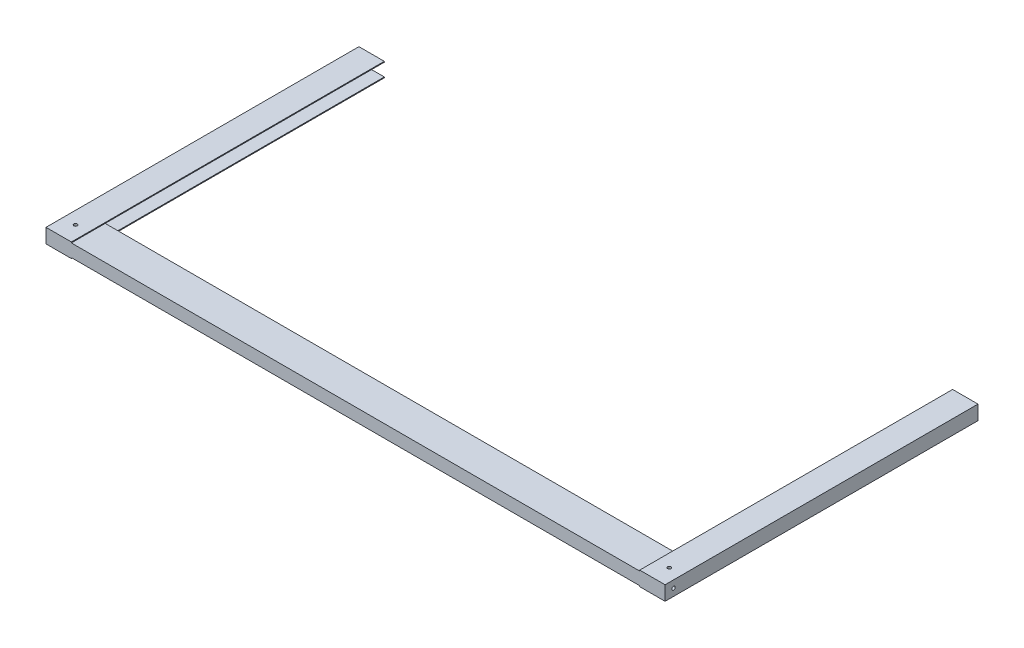
from build123d import *

# Parameters (mm, degrees)
CROQUIS1_W              = 730
CROQUIS1_H              = 15
SALIENTE_EXTRUIR1_DEPTH = 40
SALIENTE_EXTRUIR2_DEPTH = 370
CROQUIS3_R              = 2
CORTAR_EXTRUIR1_DEPTH   = 10
CROQUIS4_R              = 2
CORTAR_EXTRUIR2_DEPTH   = 10
CORTAR_EXTRUIR3_START   = -10
CROQUIS5_R              = 2
CORTAR_EXTRUIR3_DEPTH   = 10


with BuildPart() as part:
    # Croquis1 → Saliente-Extruir1 (new body)
    with BuildSketch(Plane.XY):
        Rectangle(CROQUIS1_W, CROQUIS1_H)
    extrude(amount=SALIENTE_EXTRUIR1_DEPTH)

    # Croquis2 → Saliente-Extruir2 (add)
    with BuildSketch(Plane.XY.offset(40)):
        Polygon((-366, -8.5), (-336, -8.5), (-336, -7.5), (-365, -7.5), (-365, 7.5), (-336, 7.5), (-336, 8.5), (-366, 8.5), align=None)
        Polygon((336, 8.5), (366, 8.5), (366, -8.5), (336, -8.5), (336, -7.5), (365, -7.5), (365, 7.5), (336, 7.5), align=None)
    extrude(amount=-SALIENTE_EXTRUIR2_DEPTH)

    # Croquis3 → Cortar-Extruir1 (cut)
    with BuildSketch(Plane(origin=(0, 8.5, 0), x_dir=(1, 0, 0), z_dir=(0, 1, 0))):
        with Locations(Location((351, -20, 0), (0, 0, 270))):
            Circle(CROQUIS3_R)
        with Locations(Location((-351, -20, 0), (0, 0, 270))):
            Circle(CROQUIS3_R)
    extrude(amount=-CORTAR_EXTRUIR1_DEPTH, mode=Mode.SUBTRACT)

    # Croquis4 → Cortar-Extruir2 (cut)
    with BuildSketch(Plane(origin=(366, 0, 0), x_dir=(0, 0, -1), z_dir=(1, 0, 0))):
        with Locations((-30, 0)):
            Circle(CROQUIS4_R)
    extrude(amount=-CORTAR_EXTRUIR2_DEPTH, mode=Mode.SUBTRACT)

    # Croquis5 → Cortar-Extruir3 (cut)
    with BuildSketch(Plane.ZY.offset(366).offset(CORTAR_EXTRUIR3_START)):
        with Locations(Location((30, 0, 0), (0, 0, 180))):
            Circle(CROQUIS5_R)
    extrude(amount=CORTAR_EXTRUIR3_DEPTH, mode=Mode.SUBTRACT)


solid = part.part
